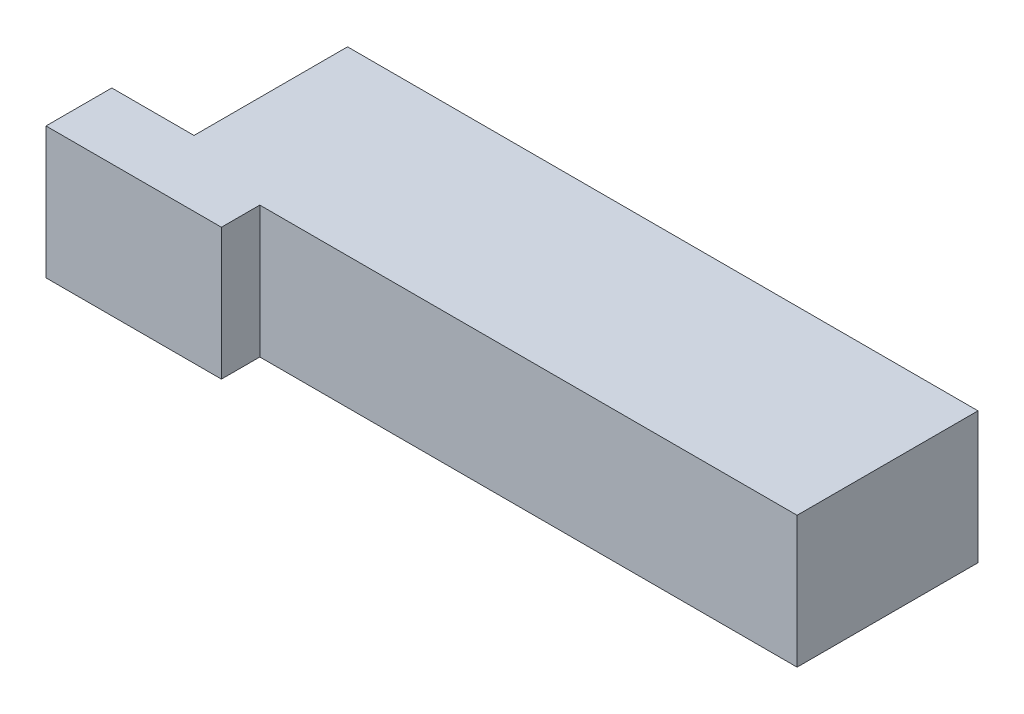
from build123d import *

# Parameters (mm, degrees)
SKETCH1_W           = 115
SKETCH1_H           = 33
BOSS_EXTRUDE1_DEPTH = 24
SKETCH2_W           = 5
SKETCH2_H           = 24
BOSS_EXTRUDE2_DEPTH = 15
SKETCH3_W           = 17
SKETCH3_H           = 24
SKETCH3_W_2         = 15
BOSS_EXTRUDE3_DEPTH = 7


with BuildPart() as part:
    # Sketch1 → Boss-Extrude1 (new body)
    with BuildSketch(Plane(origin=(0, 0, 0), x_dir=(1, 0, 0), z_dir=(0, 1, 0))):
        Rectangle(SKETCH1_W, SKETCH1_H)
    extrude(amount=BOSS_EXTRUDE1_DEPTH)

    # Sketch2 → Boss-Extrude2 (add)
    with BuildSketch(Plane.ZY.offset(57.5)):
        with Locations((14, 12)):
            Rectangle(SKETCH2_W, SKETCH2_H)
    extrude(amount=BOSS_EXTRUDE2_DEPTH)

    # Sketch3 → Boss-Extrude3 (add)
    with BuildSketch(Plane.XY.offset(16.5)):
        with Locations((-49, 12)):
            Rectangle(SKETCH3_W, SKETCH3_H)
        with Locations((-65, 12)):
            Rectangle(SKETCH3_W_2, SKETCH3_H)
    extrude(amount=BOSS_EXTRUDE3_DEPTH)


solid = part.part
